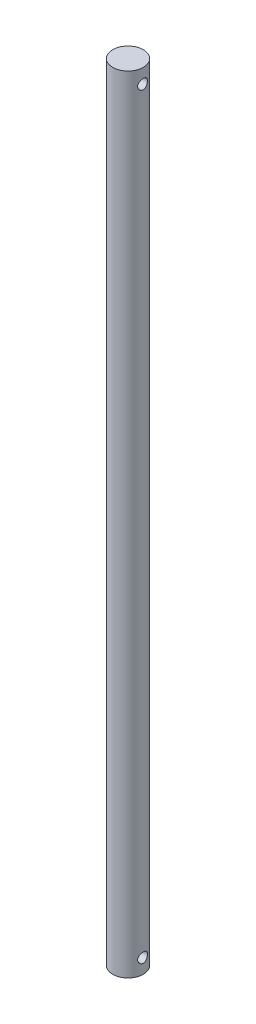
from build123d import *

# Parameters (mm, degrees)
SKETCH1_R           = 9.906
BOSS_EXTRUDE1_DEPTH = 508
CUT_EXTRUDE1_START  = 20.32
SKETCH2_R           = 3.175
CUT_EXTRUDE1_DEPTH  = 22.86


with BuildPart() as part:
    # Sketch1 → Boss-Extrude1 (new body)
    with BuildSketch(Plane(origin=(0, 0, 0), x_dir=(1, 0, 0), z_dir=(0, 1, 0))):
        with Locations(Location((0, 0, 0), (0, 0, 270))):
            Circle(SKETCH1_R)
    extrude(amount=BOSS_EXTRUDE1_DEPTH)

    # Sketch2 → Cut-Extrude1 (cut)
    with BuildSketch(Plane(origin=(0, 0, 0), x_dir=(0, 0, -1), z_dir=(1, 0, 0)).offset(CUT_EXTRUDE1_START)):
        with Locations((0, 498.602)):
            Circle(SKETCH2_R)
    cut_extrude1 = extrude(amount=-CUT_EXTRUDE1_DEPTH, mode=Mode.SUBTRACT)

    # Mirror1: Cut-Extrude1 across plane
    add(cut_extrude1.mirror(Plane.ZX.offset(254)), mode=Mode.SUBTRACT)


solid = part.part
